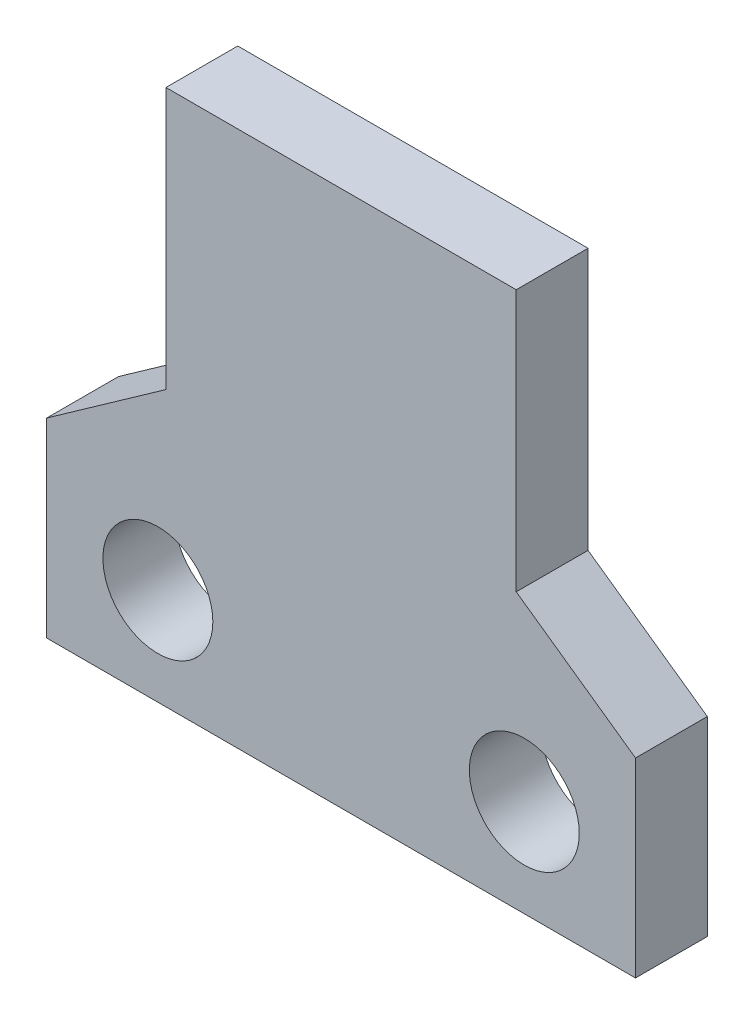
from build123d import *

# Parameters (mm, degrees)
SCHIZZO1_W                   = 16.07
SCHIZZO1_H                   = 14.64
ESTRUSIONE_ESTRUSIONE1_DEPTH = 1.96
TAGLIO_ESTRUSIONE1_DEPTH     = 12.044692164
SCHIZZO3_R                   = 1.5
TAGLIO_ESTRUSIONE2_DEPTH     = 12.044692164


with BuildPart() as part:
    # Schizzo1 → Estrusione-Estrusione1 (new body)
    with BuildSketch(Plane.XY):
        Rectangle(SCHIZZO1_W, SCHIZZO1_H)
    extrude(amount=-ESTRUSIONE_ESTRUSIONE1_DEPTH)

    # Schizzo2 → Taglio-Estrusione1 (cut, through all)
    with BuildSketch(Plane.XY):
        Polygon((-4.78, 0.18), (-4.78, 7.32), (-8.035, 7.32), (-8.035, -2.12), align=None)
        Polygon((8.035, 7.32), (4.78, 7.32), (4.78, 0.18), (8.035, -2.12), align=None)
    extrude(amount=-TAGLIO_ESTRUSIONE1_DEPTH, mode=Mode.SUBTRACT)

    # Schizzo3 → Taglio-Estrusione2 (cut, through all)
    with BuildSketch(Plane.XY):
        with Locations((-5, -4.67)):
            Circle(SCHIZZO3_R)
        with Locations((5, -4.67)):
            Circle(SCHIZZO3_R)
    extrude(amount=-TAGLIO_ESTRUSIONE2_DEPTH, mode=Mode.SUBTRACT)


solid = part.part
